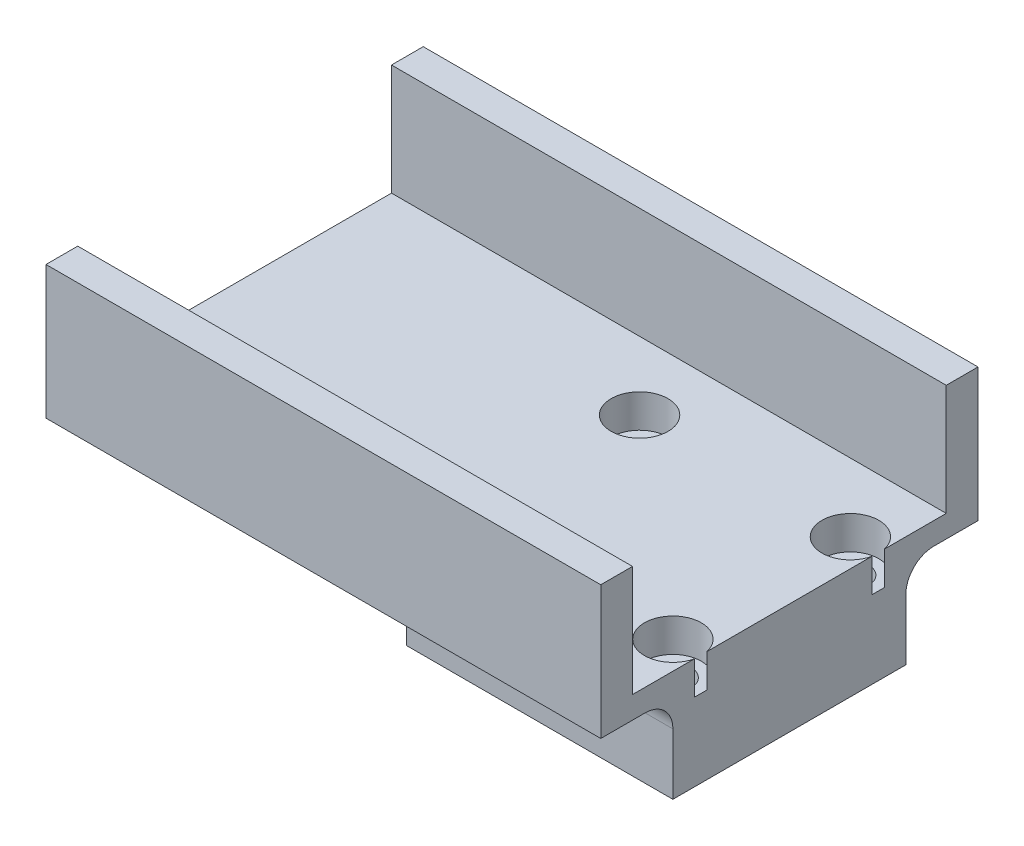
from build123d import *

# Parameters (mm, degrees)
SKETCH1_W           = 24
SKETCH1_H           = 21
SKETCH1_R           = 1.625
BOSS_EXTRUDE1_DEPTH = 8
SKETCH2_W           = 50
SKETCH2_H           = 34
SKETCH2_R           = 1.625
BOSS_EXTRUDE2_DEPTH = 2
FILLET2_R           = 2.5
SKETCH3_W           = 50
SKETCH3_H           = 2.861592732
BOSS_EXTRUDE3_DEPTH = 10
SKETCH4_R           = 2.5625
CUT_EXTRUDE3_DEPTH  = 3


with BuildPart() as part:
    # Sketch1 → Boss-Extrude1 (new body)
    with BuildSketch(Plane(origin=(0, 0, 0), x_dir=(1, 0, 0), z_dir=(0, 1, 0))):
        Rectangle(SKETCH1_W, SKETCH1_H)
        with Locations(Location((-9.5, 8, 0), (0, 0, 270))):
            Circle(SKETCH1_R, mode=Mode.SUBTRACT)
        with Locations(Location((9.5, 8, 0), (0, 0, 270))):
            Circle(SKETCH1_R, mode=Mode.SUBTRACT)
        with Locations(Location((9.5, -8, 0), (0, 0, 270))):
            Circle(SKETCH1_R, mode=Mode.SUBTRACT)
        with Locations(Location((-9.5, -8, 0), (0, 0, 270))):
            Circle(SKETCH1_R, mode=Mode.SUBTRACT)
    extrude(amount=BOSS_EXTRUDE1_DEPTH)

    # Sketch2 → Boss-Extrude2 (add)
    with BuildSketch(Plane(origin=(0, 8, 0), x_dir=(1, 0, 0), z_dir=(0, 1, 0))):
        with Locations((-13, 0)):
            Rectangle(SKETCH2_W, SKETCH2_H)
        with Locations(Location((9.5, -8, 0), (0, 0, 270))):
            Circle(SKETCH2_R, mode=Mode.SUBTRACT)
        with Locations(Location((-9.5, -8, 0), (0, 0, 270))):
            Circle(SKETCH2_R, mode=Mode.SUBTRACT)
        with Locations(Location((9.5, 8, 0), (0, 0, 270))):
            Circle(SKETCH2_R, mode=Mode.SUBTRACT)
        with Locations(Location((-9.5, 8, 0), (0, 0, 270))):
            Circle(SKETCH2_R, mode=Mode.SUBTRACT)
    extrude(amount=BOSS_EXTRUDE2_DEPTH)

    # Fillet2
    fillet2_edges = [part.edges().sort_by_distance(p)[0] for p in [
        (0, 8, -10.5),
        (-12, 8, 0),
        (0, 8, 10.5),
    ]]
    fillet(fillet2_edges, radius=FILLET2_R)

    # Sketch3 → Boss-Extrude3 (add)
    with BuildSketch(Plane(origin=(0, 10, 0), x_dir=(1, 0, 0), z_dir=(0, 1, 0))):
        with Locations((-13, 15.569203634)):
            Rectangle(SKETCH3_W, SKETCH3_H)
        with Locations((-13, -15.569203634)):
            Rectangle(SKETCH3_W, SKETCH3_H)
    extrude(amount=BOSS_EXTRUDE3_DEPTH)

    # Sketch4 → Cut-Extrude3 (cut)
    with BuildSketch(Plane(origin=(0, 10, 0), x_dir=(1, 0, 0), z_dir=(0, 1, 0))):
        with Locations(Location((-9.5, 8, 0), (0, 0, 270))):
            Circle(SKETCH4_R)
        with Locations((9.5, 8)):
            Circle(SKETCH4_R)
        with Locations((9.5, -8)):
            Circle(SKETCH4_R)
        with Locations(Location((-9.5, -8, 0), (0, 0, 270))):
            Circle(SKETCH4_R)
    extrude(amount=-CUT_EXTRUDE3_DEPTH, mode=Mode.SUBTRACT)


solid = part.part
